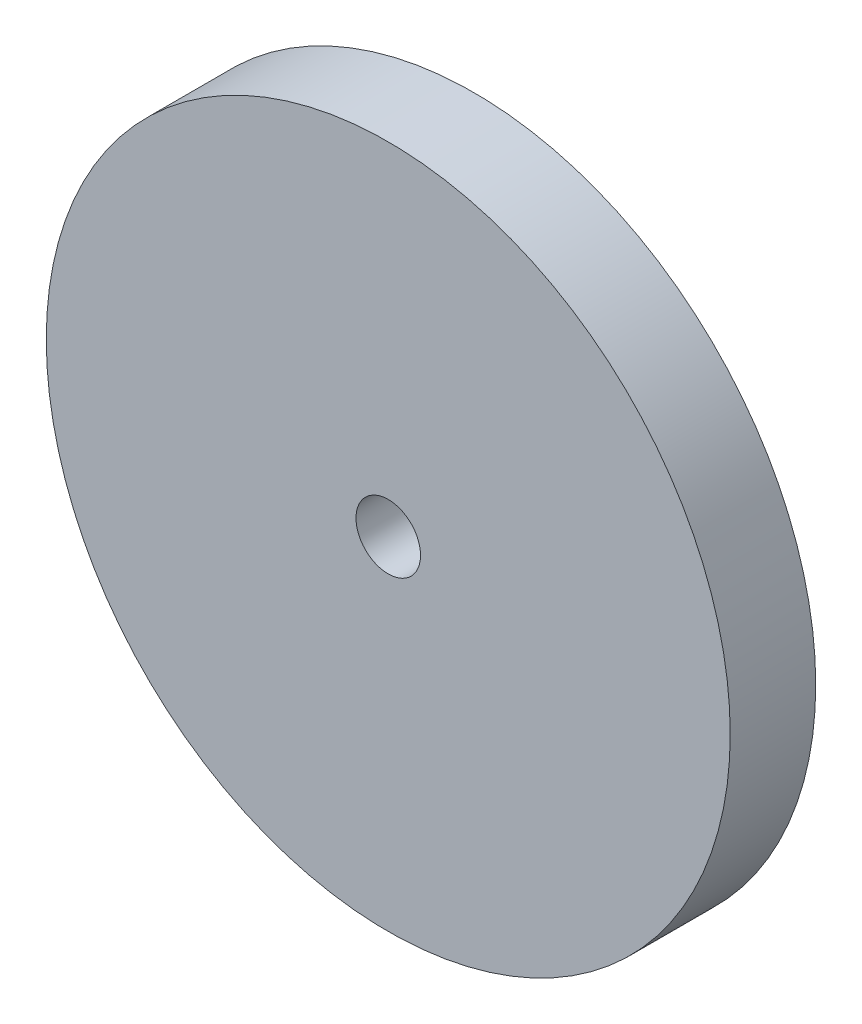
from build123d import *

# Parameters (mm, degrees)
SKETCH1_R           = 40
SKETCH1_R_2         = 3.775
BOSS_EXTRUDE1_DEPTH = 10


with BuildPart() as part:
    # Sketch1 → Boss-Extrude1 (new body)
    with BuildSketch(Plane.XY):
        Circle(SKETCH1_R)
        Circle(SKETCH1_R_2, mode=Mode.SUBTRACT)
    extrude(amount=BOSS_EXTRUDE1_DEPTH)


solid = part.part
